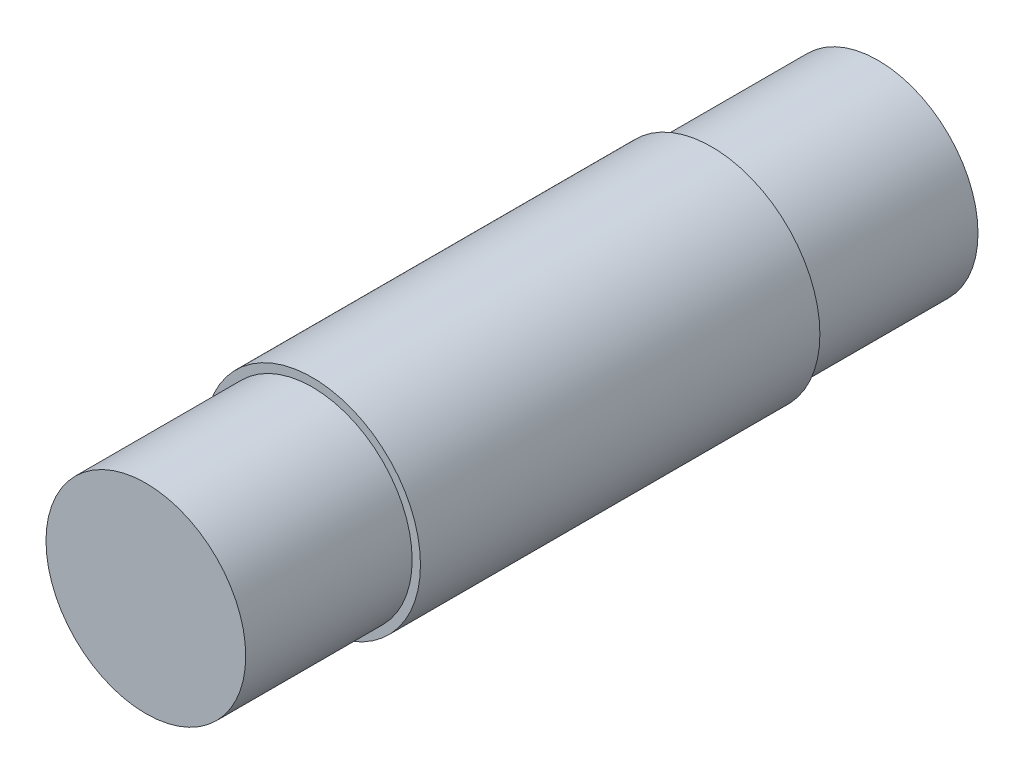
from build123d import *

# Parameters (mm, degrees)
SKETCH_1_R      = 3
EXTRUDE_1_DEPTH = 5
SKETCH_2_R      = 3.25
EXTRUDE_2_DEPTH = 12
SKETCH_3_R      = 3
EXTRUDE_3_DEPTH = 5


with BuildPart() as part:
    # ｽｹｯﾁ1 → ﾎﾞｽ - 押し出し1 (new body)
    with BuildSketch(Plane.XY):
        Circle(SKETCH_1_R)
    extrude(amount=EXTRUDE_1_DEPTH)

    # ｽｹｯﾁ2 → ﾎﾞｽ - 押し出し2 (add)
    with BuildSketch(Plane.XY.offset(5)):
        Circle(SKETCH_2_R)
    extrude(amount=EXTRUDE_2_DEPTH)

    # ｽｹｯﾁ3 → ﾎﾞｽ - 押し出し3 (add)
    with BuildSketch(Plane.XY.offset(17)):
        Circle(SKETCH_3_R)
    extrude(amount=EXTRUDE_3_DEPTH)


solid = part.part
